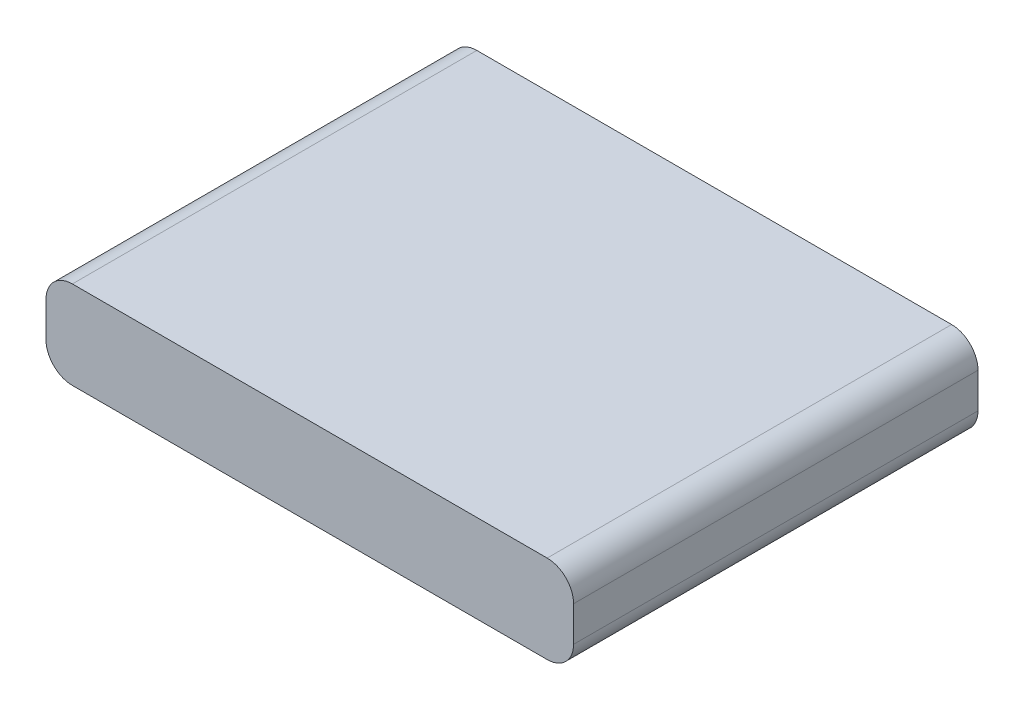
from build123d import *

# Parameters (mm, degrees)
BOSS_EXTRUDE1_DEPTH = 23
SKETCH2_R           = 2
CUT_EXTRUDE1_DEPTH  = 7.5


with BuildPart() as part:
    # Sketch1 → Boss-Extrude1 (new, symmetric)
    with BuildSketch(Plane.XY):
        with BuildLine():
            Line((-27, 0), (27, 0))
            ThreePointArc((27, 0), (29.121320344, 0.878679656), (30, 3))
            Line((30, 3), (30, 7))
            ThreePointArc((30, 7), (29.121320344, 9.121320344), (27, 10))
            Line((27, 10), (-27, 10))
            ThreePointArc((-27, 10), (-29.121320344, 9.121320344), (-30, 7))
            Line((-30, 7), (-30, 3))
            ThreePointArc((-30, 3), (-29.121320344, 0.878679656), (-27, 0))
        make_face()
    extrude(amount=BOSS_EXTRUDE1_DEPTH, both=True)

    # Sketch2 → Cut-Extrude1 (cut)
    with BuildSketch(Plane(origin=(0, 0, 0), x_dir=(1, 0, 0), z_dir=(0, 1, 0))):
        with Locations(Location((12, -17.5, 0), (0, 0, 270))):
            Circle(SKETCH2_R)
        with Locations(Location((-12, 17.5, 0), (0, 0, 270))):
            Circle(SKETCH2_R)
    extrude(amount=CUT_EXTRUDE1_DEPTH, mode=Mode.SUBTRACT)


solid = part.part
